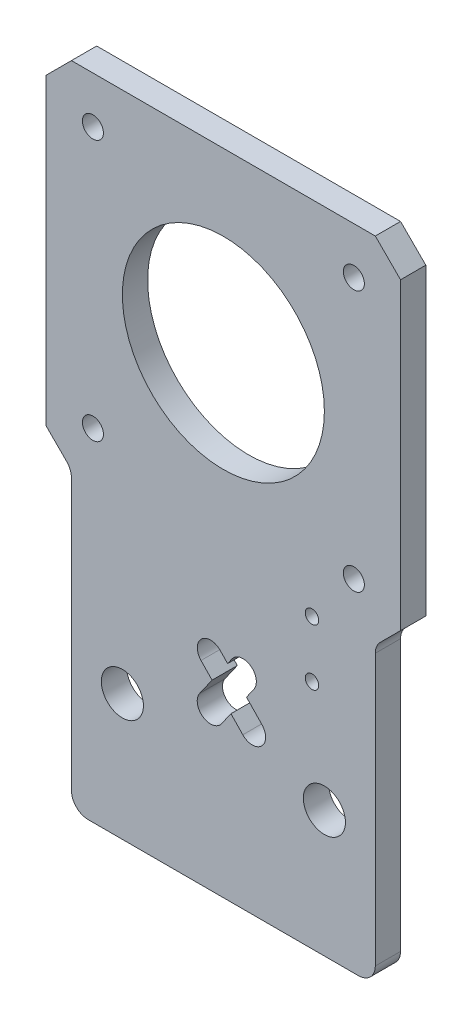
from build123d import *

# Parameters (mm, degrees)
SKETCH1_R                   = 12
BOSS_EXTRUDE1_DEPTH         = 3
TAP_DRILL_FOR_M3_TAP1_D     = 2.5
TAP_DRILL_FOR_M3_TAP1_DEPTH = 5
TAP_DRILL_FOR_M3_TAP1_TIP   = 0.751075774
TAP_DRILL_FOR_M4_TAP1_D     = 5
TAP_DRILL_FOR_M4_TAP1_DEPTH = 5
TAP_DRILL_FOR_M4_TAP1_TIP   = 1.502151548
FILLET1_R                   = 2
TAP_DRILL_FOR_M2_TAP1_D     = 1.6
TAP_DRILL_FOR_M2_TAP1_DEPTH = 5
TAP_DRILL_FOR_M2_TAP1_TIP   = 0.480688495
CUT_EXTRUDE1_DEPTH          = 10


with BuildPart() as part:
    # Sketch1 → Boss-Extrude1 (new body)
    with BuildSketch(Plane.XY):
        Polygon((18.05, -56.055), (18.05, -21.05), (21.05, -18.05), (21.05, 18.05), (18.05, 21.05), (-18.05, 21.05), (-21.05, 18.05), (-21.05, -18.05), (-18.05, -21.05), (-18.05, -56.055), align=None)
        Circle(SKETCH1_R, mode=Mode.SUBTRACT)
    extrude(amount=BOSS_EXTRUDE1_DEPTH)

    # Tap Drill for M3 Tap1
    with Locations(Plane.XY.offset(3)):
        with Locations((-15.5, 15.5), (15.5, 15.5), (-15.5, -15.5), (15.5, -15.5)):
            Hole(TAP_DRILL_FOR_M3_TAP1_D / 2, depth=TAP_DRILL_FOR_M3_TAP1_DEPTH)
            with Locations((0, 0, -(TAP_DRILL_FOR_M3_TAP1_DEPTH + TAP_DRILL_FOR_M3_TAP1_TIP / 2))):  # 118° drill point
                Cone(0, TAP_DRILL_FOR_M3_TAP1_D / 2, TAP_DRILL_FOR_M3_TAP1_TIP, mode=Mode.SUBTRACT)

    # Tap Drill for M4 Tap1
    with Locations(Plane.XY.offset(3)):
        with Locations((12, -41.055), (-12, -41.055)):
            Hole(TAP_DRILL_FOR_M4_TAP1_D / 2, depth=TAP_DRILL_FOR_M4_TAP1_DEPTH)
            with Locations((0, 0, -(TAP_DRILL_FOR_M4_TAP1_DEPTH + TAP_DRILL_FOR_M4_TAP1_TIP / 2))):  # 118° drill point
                Cone(0, TAP_DRILL_FOR_M4_TAP1_D / 2, TAP_DRILL_FOR_M4_TAP1_TIP, mode=Mode.SUBTRACT)

    # Fillet1
    fillet1_edges = [part.edges().sort_by_distance(p)[0] for p in [
        (18.05, -21.05, 1.5),
        (18.05, -56.055, 1.5),
        (-18.05, -56.055, 1.5),
        (-18.05, -21.05, 1.5),
    ]]
    fillet(fillet1_edges, radius=FILLET1_R)

    # Tap Drill for M2 Tap1
    with Locations(Plane.XY.offset(3)):
        with Locations((10.52945603, -21.86131015), (10.52945603, -28.56131015)):
            Hole(TAP_DRILL_FOR_M2_TAP1_D / 2, depth=TAP_DRILL_FOR_M2_TAP1_DEPTH)
            with Locations((0, 0, -(TAP_DRILL_FOR_M2_TAP1_DEPTH + TAP_DRILL_FOR_M2_TAP1_TIP / 2))):  # 118° drill point
                Cone(0, TAP_DRILL_FOR_M2_TAP1_D / 2, TAP_DRILL_FOR_M2_TAP1_TIP, mode=Mode.SUBTRACT)

    # Sketch8 → Cut-Extrude1 (cut)
    with BuildSketch(Plane.XY):
        with BuildLine():
            Line((0.899883871, -36.671612752), (-0.221262765, -38.266132411))
            ThreePointArc((-0.221262765, -38.266132411), (-2.432977147, -38.651660606), (-2.818505343, -36.439946223))
            Line((-2.818505343, -36.439946223), (-1.341666159, -34.339552718))
            Line((-1.341666159, -34.339552718), (-2.655433384, -32.972737792))
            ThreePointArc((-2.655433384, -32.972737792), (-2.611361373, -30.745711142), (-0.384334723, -30.789783153))
            Line((-0.384334723, -30.789783153), (0.504250938, -31.714248402))
            Line((0.504250938, -31.714248402), (1.028839157, -30.968167379))
            ThreePointArc((1.028839157, -30.968167379), (3.24055354, -30.582639184), (3.626081735, -32.794353566))
            Line((3.626081735, -32.794353566), (2.745800968, -34.046308435))
            Line((2.745800968, -34.046308435), (4.580323387, -35.954905771))
            ThreePointArc((4.580323387, -35.954905771), (4.536251377, -38.181932421), (2.309224727, -38.137860411))
            Line((2.309224727, -38.137860411), (0.899883871, -36.671612752))
        make_face()
    extrude(amount=CUT_EXTRUDE1_DEPTH, mode=Mode.SUBTRACT)


solid = part.part
